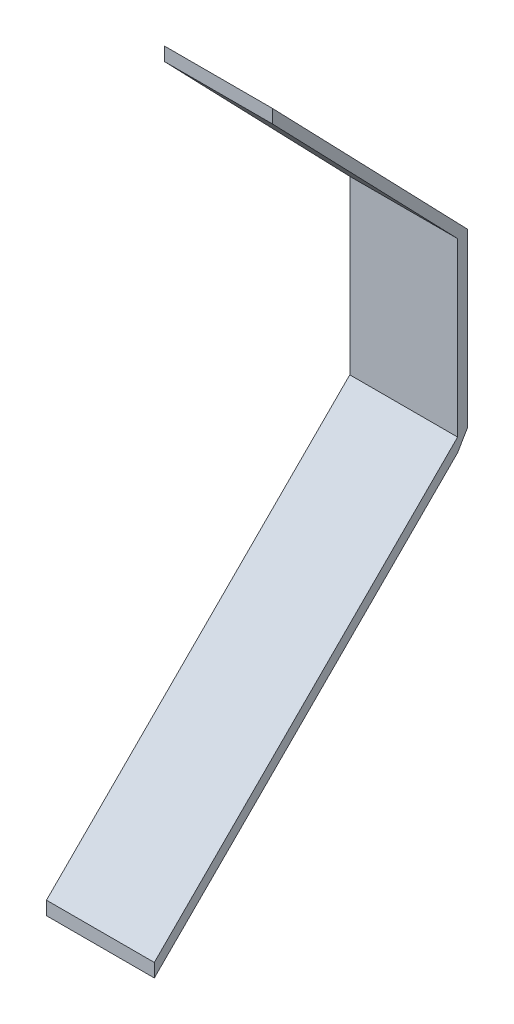
from build123d import *

# Parameters (mm, degrees)
EXTRUDE_1_DEPTH = 32


with BuildPart() as part:
    # 草图3 → 凸台-拉伸1 (new body)
    with BuildSketch(Plane(origin=(0, 0, 0), x_dir=(0, 0, -1), z_dir=(1, 0, 0))):
        Polygon((0, 4), (0, 0), (90, 90), (92.937191873, 94.95600115), (92.937191873, 145.95600115), (90, 149), (35, 206), (35, 202), (90, 145), (90, 94), align=None)
    extrude(amount=EXTRUDE_1_DEPTH)


solid = part.part
